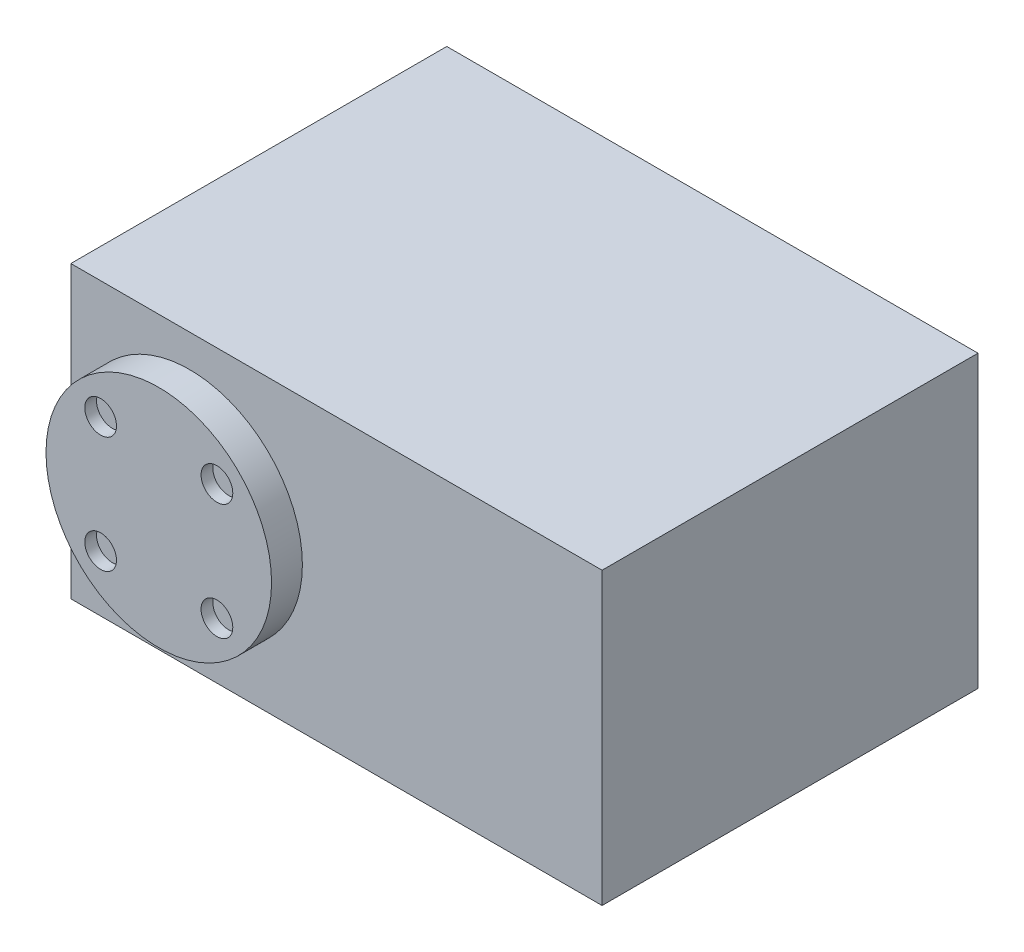
from build123d import *

# Parameters (mm, degrees)
S_BOX1_W     = 45.22
S_BOX1_H     = 24.72
BOSS_1_DEPTH = 32
S_CYL2_R     = 9.6
BOSS_2_DEPTH = 3.125
S_CYL3_R     = 9.6
BOSS_3_DEPTH = 3.125
S_HOLE4_R    = 1.35
HOLE_4_DEPTH = 1.1
S_HOLE5_R    = 1.35
HOLE_5_DEPTH = 1.1
S_HOLE6_R    = 1.35
HOLE_6_DEPTH = 1.1
S_HOLE7_R    = 1.35
HOLE_7_DEPTH = 1.1


with BuildPart() as part:
    # S_box1 → Boss_1 (new body)
    with BuildSketch(Plane.XY.offset(-16)):
        with Locations((12.5, 0)):
            Rectangle(S_BOX1_W, S_BOX1_H)
    extrude(amount=BOSS_1_DEPTH)

    # S_cyl2 → Boss_2 (add)
    with BuildSketch(Plane.XY.offset(15.5)):
        Circle(S_CYL2_R)
    extrude(amount=BOSS_2_DEPTH)

    # S_cyl3 → Boss_3 (add)
    with BuildSketch(Plane.XY.offset(-18.625)):
        Circle(S_CYL3_R)
    extrude(amount=BOSS_3_DEPTH)

    # S_hole4 → Hole_4 (cut)
    with BuildSketch(Plane.XY.offset(17.625)):
        with Locations((4.949747468, 4.949747468)):
            Circle(S_HOLE4_R)
    extrude(amount=HOLE_4_DEPTH, mode=Mode.SUBTRACT)

    # S_hole5 → Hole_5 (cut)
    with BuildSketch(Plane.XY.offset(17.625)):
        with Locations((-4.949747468, 4.949747468)):
            Circle(S_HOLE5_R)
    extrude(amount=HOLE_5_DEPTH, mode=Mode.SUBTRACT)

    # S_hole6 → Hole_6 (cut)
    with BuildSketch(Plane.XY.offset(17.625)):
        with Locations((-4.949747468, -4.949747468)):
            Circle(S_HOLE6_R)
    extrude(amount=HOLE_6_DEPTH, mode=Mode.SUBTRACT)

    # S_hole7 → Hole_7 (cut)
    with BuildSketch(Plane.XY.offset(17.625)):
        with Locations((4.949747468, -4.949747468)):
            Circle(S_HOLE7_R)
    extrude(amount=HOLE_7_DEPTH, mode=Mode.SUBTRACT)


solid = part.part
